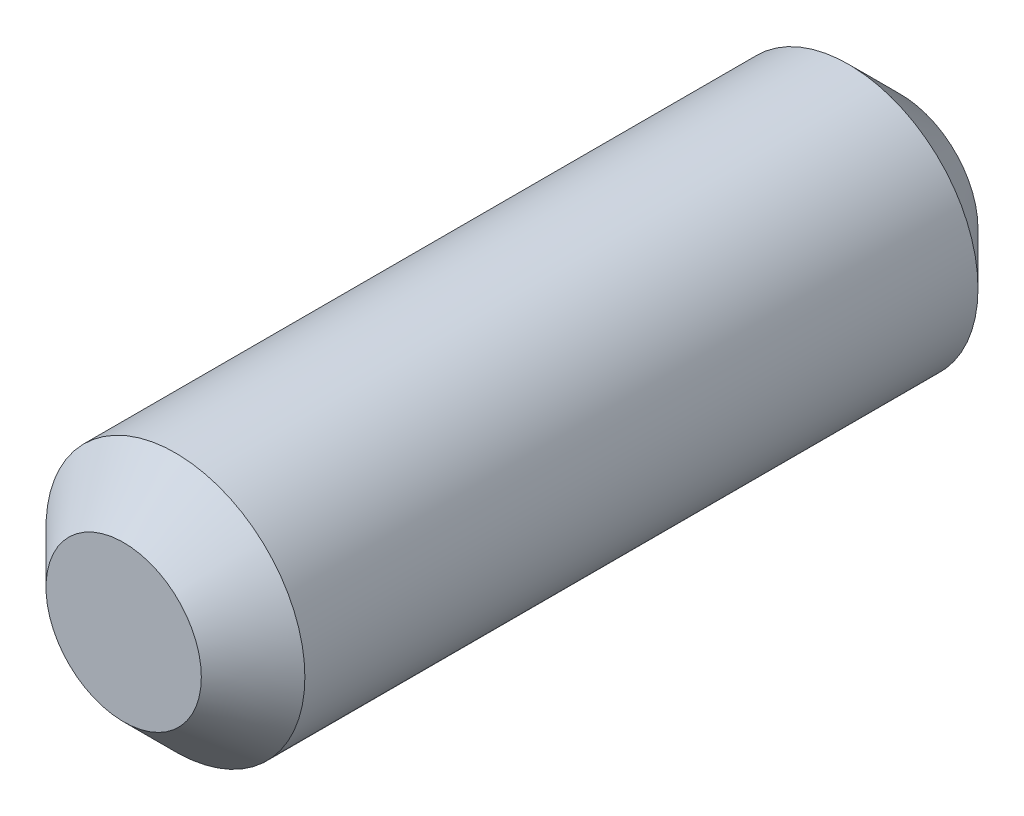
from build123d import *

# Parameters (mm, degrees)
SKETCH1_R          = 5
BASE_EXTRUDE_DEPTH = 30
CHAMFER1_SIZE      = 2


with BuildPart() as part:
    # Sketch1 → Base-Extrude (new body)
    with BuildSketch(Plane.XY):
        Circle(SKETCH1_R)
    extrude(amount=BASE_EXTRUDE_DEPTH)

    # Chamfer1
    chamfer1_edges = [part.edges().sort_by_distance(p)[0] for p in [
        (-5, 0, 0),
        (-5, 0, 30),
    ]]
    chamfer(chamfer1_edges, length=CHAMFER1_SIZE)


solid = part.part
